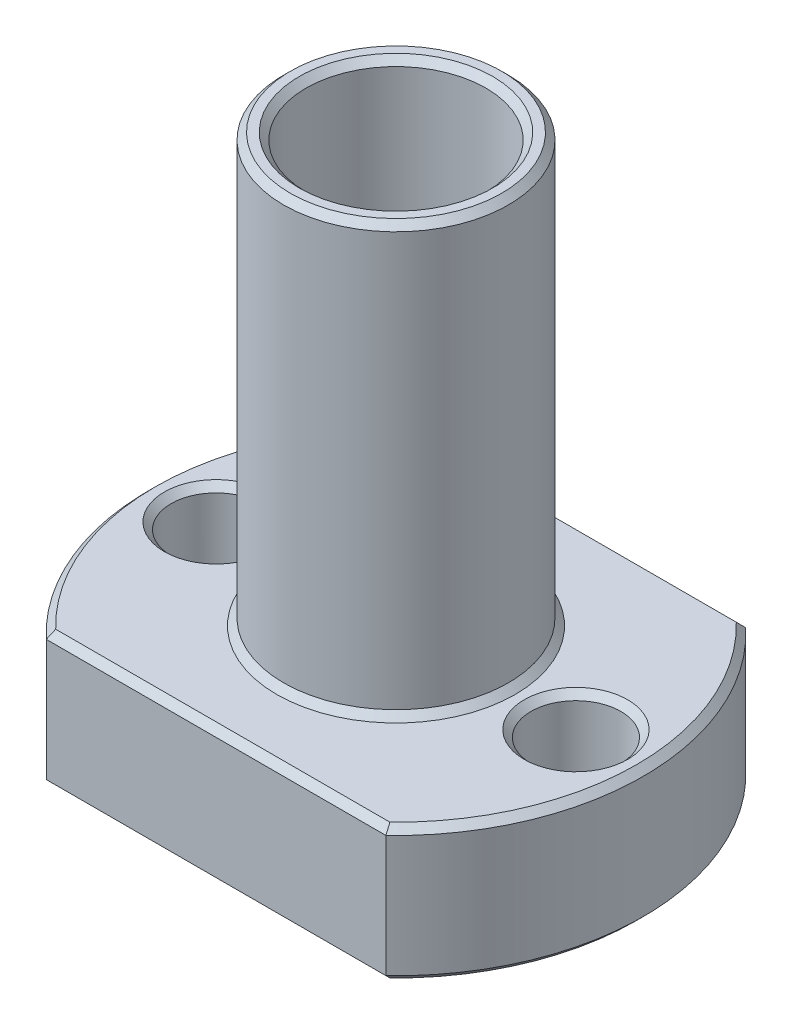
from build123d import *

# Parameters (mm, degrees)
CROQUIS1_R              = 4
CROQUIS1_R_2            = 2
SALIENTE_EXTRUIR1_DEPTH = 6
CROQUIS2_R              = 5
CROQUIS2_R_2            = 4
SALIENTE_EXTRUIR2_DEPTH = 19
CHAFL_N1_SIZE           = 0.3


with BuildPart() as part:
    # Croquis1 → Saliente-Extruir1 (new body)
    with BuildSketch(Plane(origin=(0, 0, 0), x_dir=(1, 0, 0), z_dir=(0, 1, 0))):
        with BuildLine():
            Line((7.549834435, 8), (-7.549834435, 8))
            ThreePointArc((-7.549834435, 8), (-11, 0), (-7.549834435, -8))
            Line((-7.549834435, -8), (7.549834435, -8))
            ThreePointArc((7.549834435, -8), (11, 0), (7.549834435, 8))
        make_face()
        with Locations(Location((0, 0, 0), (0, 0, 270))):
            Circle(CROQUIS1_R, mode=Mode.SUBTRACT)
        with Locations(Location((-8, 0, 0), (0, 0, 270))):
            Circle(CROQUIS1_R_2, mode=Mode.SUBTRACT)
        with Locations(Location((8, 0, 0), (0, 0, 270))):
            Circle(CROQUIS1_R_2, mode=Mode.SUBTRACT)
    extrude(amount=SALIENTE_EXTRUIR1_DEPTH)

    # Croquis2 → Saliente-Extruir2 (add)
    with BuildSketch(Plane(origin=(0, 6, 0), x_dir=(1, 0, 0), z_dir=(0, 1, 0))):
        with Locations(Location((0, 0, 0), (0, 0, 270))):
            Circle(CROQUIS2_R)
        with Locations(Location((0, 0, 0), (0, 0, 270))):
            Circle(CROQUIS2_R_2, mode=Mode.SUBTRACT)
    extrude(amount=SALIENTE_EXTRUIR2_DEPTH)

    # Chaflán1
    chafl_n1_edges = [part.edges().sort_by_distance(p)[0] for p in [
        (-11, 6, 0),
        (0, 0, -4),
        (0, 6, 8),
        (-8, 0, -2),
        (-8, 6, -2),
        (8, 0, -2),
        (8, 6, -2),
        (0, 25, -5),
        (0, 6, -5),
        (0, 25, -4),
        (11, 6, 0),
        (0, 0, 8),
        (-11, 0, 0),
        (0, 0, -8),
        (11, 0, 0),
        (0, 6, -8),
    ]]
    chamfer(chafl_n1_edges, length=CHAFL_N1_SIZE)


solid = part.part
